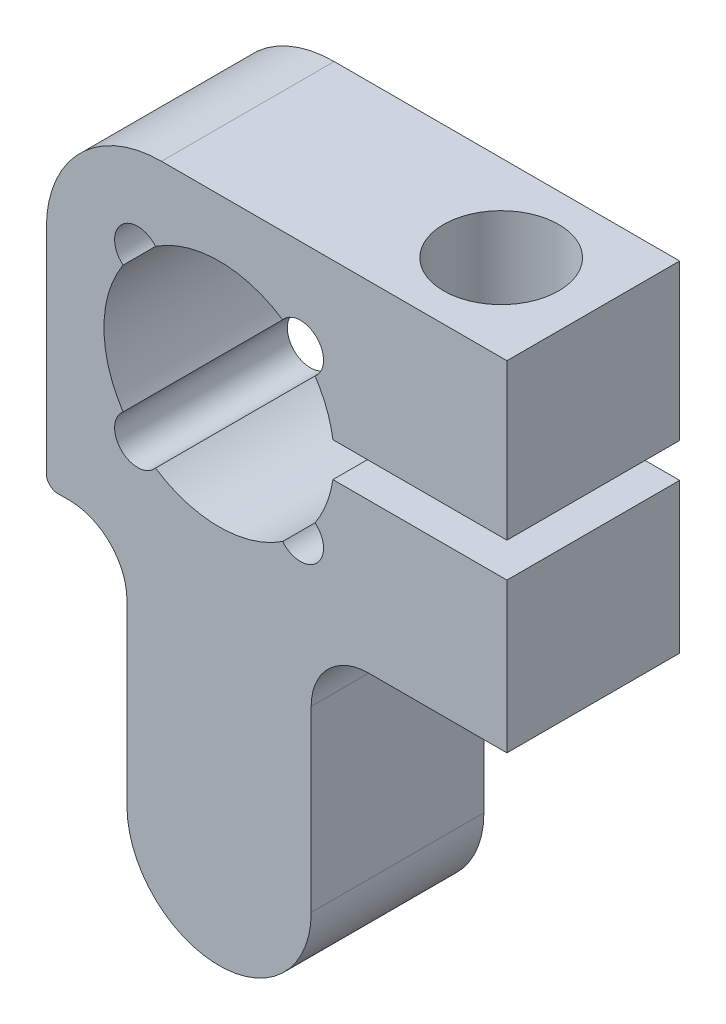
from build123d import *

# Parameters (mm, degrees)
EXTRUDE_1_DEPTH     = 15
SKETCH_2_R          = 3.4
CUT_EXTRUDE_2_DEPTH = 1193.231762859
SKETCH_3_R          = 5
CUT_EXTRUDE_3_DEPTH = 14


with BuildPart() as part:
    # 草图1 → 拉伸1 (new body)
    with BuildSketch(Plane.XY):
        with BuildLine():
            Line((1175.612511144, 1087.358821907), (1190.725651177, 1087.358821907))
            Line((1190.725651177, 1087.358821907), (1190.725651177, 1100.858821907))
            Line((1190.725651177, 1100.858821907), (1160.725651177, 1100.858821907))
            ThreePointArc((1160.725651177, 1100.858821907), (1153.654583365, 1097.929889719), (1150.725651177, 1090.858821907))
            Line((1150.725651177, 1090.858821907), (1150.725651177, 1072.358821907))
            ThreePointArc((1150.725651177, 1072.358821907), (1151.018544396, 1071.651715126), (1151.725651177, 1071.358821907))
            Line((1151.725651177, 1071.358821907), (1152.725651177, 1071.358821907))
            ThreePointArc((1152.725651177, 1071.358821907), (1156.261185083, 1069.894355813), (1157.725651177, 1066.358821907))
            Line((1157.725651177, 1066.358821907), (1157.725651177, 1050.858821907))
            ThreePointArc((1157.725651177, 1050.858821907), (1165.725651177, 1042.858821907), (1173.725651177, 1050.858821907))
            Line((1173.725651177, 1050.858821907), (1173.725651177, 1066.358821907))
            ThreePointArc((1173.725651177, 1066.358821907), (1175.190117271, 1069.894355813), (1178.725651177, 1071.358821907))
            Line((1178.725651177, 1071.358821907), (1190.725651177, 1071.358821907))
            Line((1190.725651177, 1071.358821907), (1190.725651177, 1084.358821907))
            Line((1190.725651177, 1084.358821907), (1175.612511144, 1084.358821907))
            ThreePointArc((1175.612511144, 1084.358821907), (1175.056800803, 1082.26304012), (1174.062422361, 1080.336300179))
            ThreePointArc((1174.062422361, 1080.336300179), (1174.210932551, 1077.373540533), (1171.248172905, 1077.522050723))
            ThreePointArc((1171.248172905, 1077.522050723), (1165.725651177, 1075.858821907), (1160.203129449, 1077.522050723))
            ThreePointArc((1160.203129449, 1077.522050723), (1157.240369803, 1077.373540533), (1157.388879993, 1080.336300179))
            ThreePointArc((1157.388879993, 1080.336300179), (1155.725651177, 1085.858821907), (1157.388879993, 1091.381343635))
            ThreePointArc((1157.388879993, 1091.381343635), (1157.240369803, 1094.344103281), (1160.203129449, 1094.195593091))
            ThreePointArc((1160.203129449, 1094.195593091), (1165.725651177, 1095.858821907), (1171.248172905, 1094.195593091))
            ThreePointArc((1171.248172905, 1094.195593091), (1174.210932551, 1094.344103281), (1174.062422361, 1091.381343635))
            ThreePointArc((1174.062422361, 1091.381343635), (1175.056800803, 1089.454603694), (1175.612511144, 1087.358821907))
        make_face()
    extrude(amount=EXTRUDE_1_DEPTH)

    # 草图2 → 拉伸2 (cut, through all)
    with BuildSketch(Plane(origin=(0, 1100.858821907, 0), x_dir=(1, 0, 0), z_dir=(0, 1, 0))):
        with Locations((1182.725651177, -7.5)):
            Circle(SKETCH_2_R)
    extrude(amount=-CUT_EXTRUDE_2_DEPTH, mode=Mode.SUBTRACT)

    # 草图3 → 拉伸3 (cut)
    with BuildSketch(Plane(origin=(0, 1100.858821907, 0), x_dir=(1, 0, 0), z_dir=(0, 1, 0))):
        with Locations(Location((1182.725651177, -7.5, 0), (0, 0, 270))):
            Circle(SKETCH_3_R)
    extrude(amount=-CUT_EXTRUDE_3_DEPTH, mode=Mode.SUBTRACT)


solid = part.part
